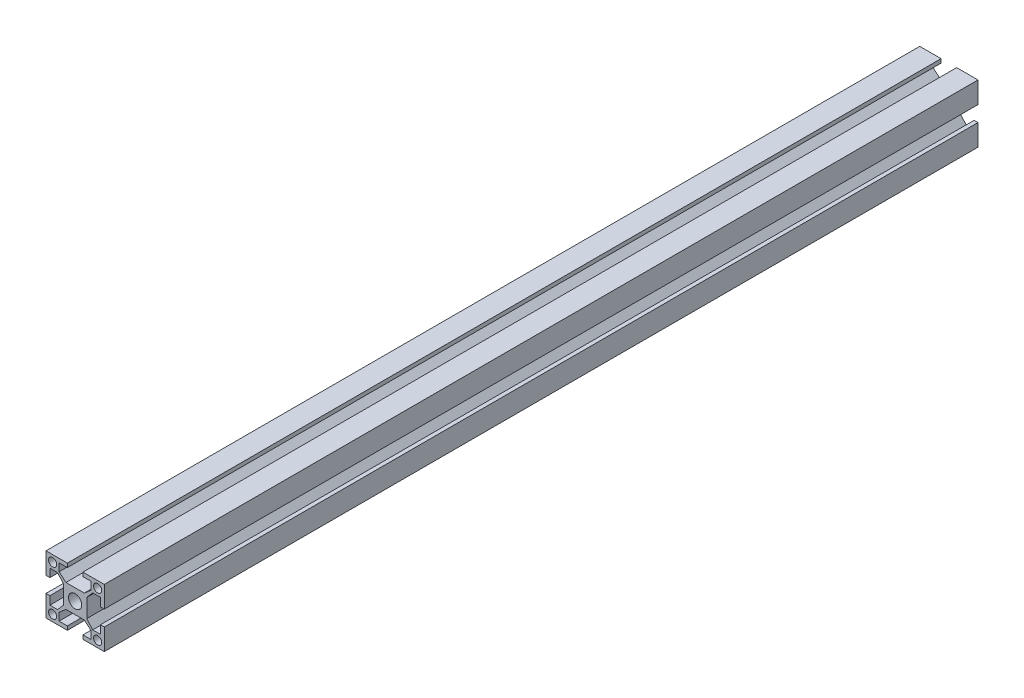
from build123d import *

# Parameters (mm, degrees)
SKETCH3_R           = 1.400007
SKETCH3_R_2         = 2.266678
BOSS_EXTRUDE1_DEPTH = 300


with BuildPart() as part:
    # Sketch3 → Boss-Extrude1 (new body)
    with BuildSketch(Plane.XY):
        Polygon((8.66671, -5.5000275), (6.019640257, -5.5000275), (4.00002, -3.150816419), (4.00002, 0), (4.00002, 3.150816419), (6.019640257, 5.5000275), (8.66671, 5.5000275), (8.66671, 2.66668), (10.00005, 2.66668), (10.00005, 10.00005), (2.66668, 10.00005), (2.66668, 8.66671), (5.5000275, 8.66671), (5.5000275, 6.019640257), (3.150816419, 4.00002), (0, 4.00002), (-3.150816419, 4.00002), (-5.5000275, 6.019640257), (-5.5000275, 8.66671), (-2.66668, 8.66671), (-2.66668, 10.00005), (-10.00005, 10.00005), (-10.00005, 2.66668), (-8.66671, 2.66668), (-8.66671, 5.5000275), (-6.019640257, 5.5000275), (-4.00002, 3.150816419), (-4.00002, 0), (-4.00002, -3.150816419), (-6.019640257, -5.5000275), (-8.66671, -5.5000275), (-8.66671, -2.66668), (-10.00005, -2.66668), (-10.00005, -10.00005), (-2.66668, -10.00005), (-2.66668, -8.66671), (-5.5000275, -8.66671), (-5.5000275, -6.019640257), (-3.150816419, -4.00002), (0, -4.00002), (3.150816419, -4.00002), (5.5000275, -6.019640257), (5.5000275, -8.66671), (2.66668, -8.66671), (2.66668, -10.00005), (10.00005, -10.00005), (10.00005, -2.66668), (8.66671, -2.66668), align=None)
        with Locations((7.733372, -7.733372)):
            Circle(SKETCH3_R, mode=Mode.SUBTRACT)
        with Locations((7.733372, 7.733372)):
            Circle(SKETCH3_R, mode=Mode.SUBTRACT)
        with Locations((-7.733372, 7.733372)):
            Circle(SKETCH3_R, mode=Mode.SUBTRACT)
        Circle(SKETCH3_R_2, mode=Mode.SUBTRACT)
        with Locations((-7.733372, -7.733372)):
            Circle(SKETCH3_R, mode=Mode.SUBTRACT)
    extrude(amount=BOSS_EXTRUDE1_DEPTH)


solid = part.part
